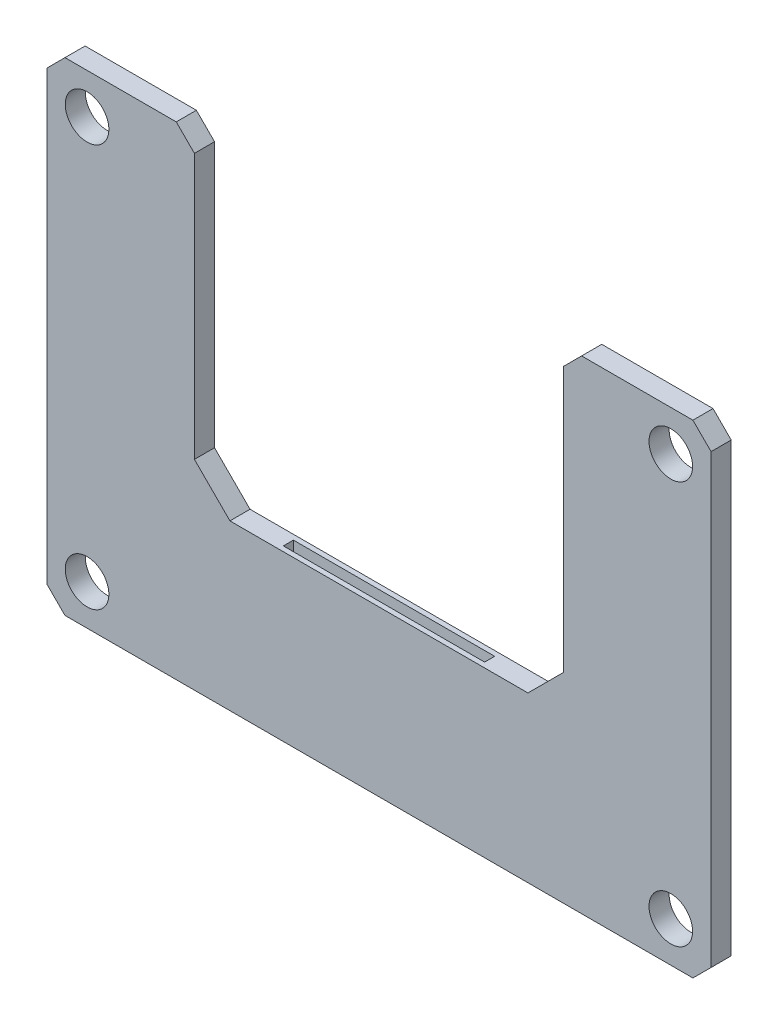
from build123d import *

# Parameters (mm, degrees)
SKETCH1_R           = 3.25
BOSS_EXTRUDE1_DEPTH = 3
CUT_EXTRUDE1_REACH  = 124.855
SKETCH2_W           = 30
SKETCH2_H           = 1.5


with BuildPart() as part:
    # Sketch1 → Boss-Extrude1 (new body)
    with BuildSketch(Plane.XY):
        Polygon((-27.792893219, 25), (-45.5, 25), (-72.207106781, 25), (-77.5, 30.292893219), (-77.5, 69.792893219), (-80.207106781, 72.5), (-96.792893219, 72.5), (-99.5, 69.792893219), (-99.5, 3.207106781), (-96.792893219, 0.5), (-50.760240095, 0.5), (-3.207106781, 0.5), (-0.5, 3.207106781), (-0.5, 69.792893219), (-3.207106781, 72.5), (-19.792893219, 72.5), (-22.5, 69.792893219), (-22.5, 30.292893219), align=None)
        with Locations((-6.5, 66.5)):
            Circle(SKETCH1_R, mode=Mode.SUBTRACT)
        with Locations((-6.5, 6.5)):
            Circle(SKETCH1_R, mode=Mode.SUBTRACT)
        with Locations((-93.5, 6.5)):
            Circle(SKETCH1_R, mode=Mode.SUBTRACT)
        with Locations((-93.5, 66.5)):
            Circle(SKETCH1_R, mode=Mode.SUBTRACT)
    extrude(amount=BOSS_EXTRUDE1_DEPTH)

    # Sketch2 → Cut-Extrude1 (cut, up to next)
    with BuildSketch(Plane.XZ.offset(-0.5), mode=Mode.PRIVATE) as cut_extrude1_sk1:
        with Locations((-50, 1.5)):
            Rectangle(SKETCH2_W, SKETCH2_H)
    cut_extrude1_tool1 = extrude(cut_extrude1_sk1.sketch, amount=-CUT_EXTRUDE1_REACH, mode=Mode.PRIVATE) & part.part
    add(cut_extrude1_tool1.solids().sort_by_distance((-50, 0.5, 1.5))[0], mode=Mode.SUBTRACT)


solid = part.part
